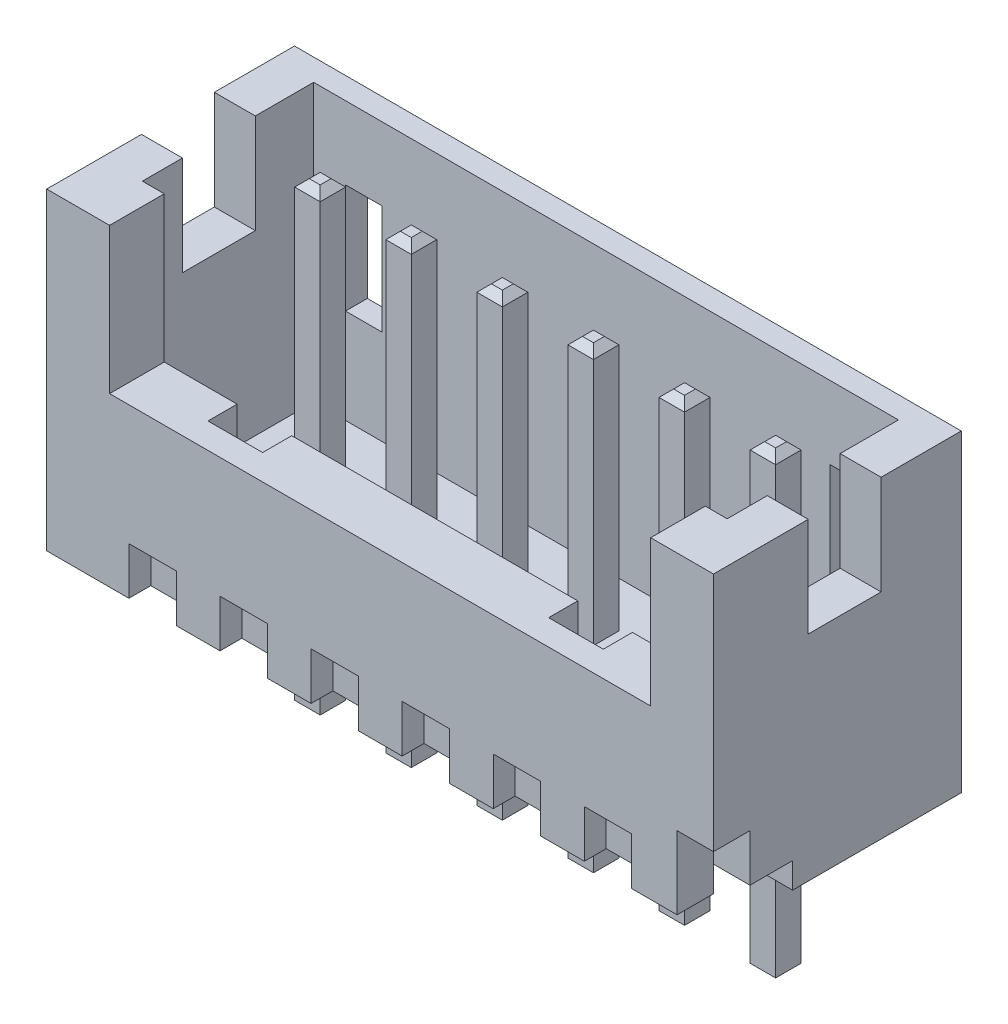
from build123d import *

# Parameters (mm, degrees)
SKETCH_1_W             = 9.15
SKETCH_1_H             = 3.4
EXTRUDE_1_DEPTH        = 4.3
SKETCH_2_W             = 8.025
SKETCH_2_H             = 2.35
CUT_EXTRUDE_1_DEPTH    = 3.8
CUT_EXTRUDE_2_REACH    = 9.14
SKETCH_3_W             = 7.425
SKETCH_3_H             = 2
CUT_EXTRUDE_3_REACH    = 9.14
SKETCH_4_W             = 0.5
SKETCH_4_H             = 1.5
PIN_DEPTH              = 3.5
PIN_DEPTH_BACK         = 2.8
SKETCH_5_W             = 0.35
SKETCH_5_H             = 0.35
CHAMFER_1_SIZE         = 0.1
PATTERN_LINEAR_3_COUNT = 6
PATTERN_LINEAR_3_PITCH = 1.25
SKETCH_6_W             = 1
SKETCH_6_H             = 1.363162743
CUT_EXTRUDE_5_DEPTH    = 0.5625
SKETCH_7_W             = 0.75
SKETCH_7_H             = 0.4
CUT_EXTRUDE_6_DEPTH    = 1.8
SKETCH_8_W             = 0.5
SKETCH_8_H             = 1
CUT_EXTRUDE_7_DEPTH    = 0.5
CUT_EXTRUDE_8_DEPTH    = 0.3
PATTERN_LINEAR_4_COUNT = 6
PATTERN_LINEAR_4_PITCH = 1.25
SKETCH_10_W            = 0.585441992
SKETCH_10_H            = 0.351135125
CUT_EXTRUDE_9_DEPTH    = 11.251951034


with BuildPart() as part:
    # Эскиз1 → Бобышка-Вытянуть1 (new body)
    with BuildSketch(Plane(origin=(0, 0, 0), x_dir=(1, 0, 0), z_dir=(0, 1, 0))):
        Rectangle(SKETCH_1_W, SKETCH_1_H)
    extrude(amount=EXTRUDE_1_DEPTH)

    # Эскиз2 → Вырез-Вытянуть1 (cut)
    with BuildSketch(Plane(origin=(0, 4.3, 0), x_dir=(1, 0, 0), z_dir=(0, 1, 0))):
        with Locations((0, 0.225)):
            Rectangle(SKETCH_2_W, SKETCH_2_H)
    extrude(amount=-CUT_EXTRUDE_1_DEPTH, mode=Mode.SUBTRACT)

    # Эскиз3 → Вырез-Вытянуть2 (cut, up to next)
    with BuildSketch(Plane.XY.offset(1.7), mode=Mode.PRIVATE) as cut_extrude_2_sk1:
        with Locations((0, 3.3)):
            Rectangle(SKETCH_3_W, SKETCH_3_H)
    cut_extrude_2_tool1 = extrude(cut_extrude_2_sk1.sketch, amount=-CUT_EXTRUDE_2_REACH, mode=Mode.PRIVATE) & part.part
    add(cut_extrude_2_tool1.solids().sort_by_distance((0, 3.3, 1.7))[0], mode=Mode.SUBTRACT)

    # Эскиз4 → Вырез-Вытянуть3 (cut, up to next)
    with BuildSketch(Plane(origin=(0, 0, -1.7), x_dir=(-1, 0, 0), z_dir=(0, 0, -1)), mode=Mode.PRIVATE) as cut_extrude_3_sk1:
        with Locations((-3.325, 2.55)):
            Rectangle(SKETCH_4_W, SKETCH_4_H)
    cut_extrude_3_tool1 = extrude(cut_extrude_3_sk1.sketch, amount=-CUT_EXTRUDE_3_REACH, mode=Mode.PRIVATE) & part.part
    # Эскиз4 → Вырез-Вытянуть3 (cut, up to next)
    with BuildSketch(Plane(origin=(0, 0, -1.7), x_dir=(-1, 0, 0), z_dir=(0, 0, -1)), mode=Mode.PRIVATE) as cut_extrude_3_sk2:
        with Locations((3.325, 2.55)):
            Rectangle(SKETCH_4_W, SKETCH_4_H)
    cut_extrude_3_tool2 = extrude(cut_extrude_3_sk2.sketch, amount=-CUT_EXTRUDE_3_REACH, mode=Mode.PRIVATE) & part.part
    add(cut_extrude_3_tool1.solids().sort_by_distance((3.325, 2.55, -1.7))[0], mode=Mode.SUBTRACT)
    add(cut_extrude_3_tool2.solids().sort_by_distance((-3.325, 2.55, -1.7))[0], mode=Mode.SUBTRACT)

    # Эскиз6 → Вырез-Вытянуть5 (cut)
    with BuildSketch(Plane.ZY.offset(4.575)):
        with Locations((-0.1, 3.618418629)):
            Rectangle(SKETCH_6_W, SKETCH_6_H)
    cut_extrude_5 = extrude(amount=-CUT_EXTRUDE_5_DEPTH, mode=Mode.SUBTRACT)

    # Эскиз7 → Вырез-Вытянуть6 (cut)
    with BuildSketch(Plane(origin=(0, 2.3, 0), x_dir=(1, 0, 0), z_dir=(0, 1, 0))):
        with Locations((-2.3375, -1.15)):
            Rectangle(SKETCH_7_W, SKETCH_7_H)
    cut_extrude_6 = extrude(amount=-CUT_EXTRUDE_6_DEPTH, mode=Mode.SUBTRACT)

    # Зеркальное отражение1: Вырез-Вытянуть5, Вырез-Вытянуть6 across plane
    add(cut_extrude_5.mirror(Plane(origin=(0, 0, 0), x_dir=(0, 0, 1), z_dir=(1, 0, 0))), mode=Mode.SUBTRACT)
    add(cut_extrude_6.mirror(Plane(origin=(0, 0, 0), x_dir=(0, 0, 1), z_dir=(1, 0, 0))), mode=Mode.SUBTRACT)

    # Эскиз8 → Вырез-Вытянуть7 (cut)
    with BuildSketch(Plane.XY.offset(1.7)):
        with Locations((4.325, 0.5)):
            Rectangle(SKETCH_8_W, SKETCH_8_H)
    extrude(amount=-CUT_EXTRUDE_7_DEPTH, mode=Mode.SUBTRACT)

    # Эскиз9 → Вырез-Вытянуть8 (cut)
    with BuildSketch(Plane.XY.offset(1.7)):
        Polygon((-3.4475, 0.65), (-3.4475, 0), (-2.7975, 0), (-2.7975, 0.65), (-3.1225, 0.65), align=None)
    cut_extrude_8 = extrude(amount=-CUT_EXTRUDE_8_DEPTH, mode=Mode.SUBTRACT)

    # Линейный массив4: Вырез-Вытянуть8 ×6
    with Locations(*[(i * PATTERN_LINEAR_4_PITCH, 0, 0) for i in range(1, PATTERN_LINEAR_4_COUNT)]):
        add(cut_extrude_8, mode=Mode.SUBTRACT)

    # Эскиз10 → Вырез-Вытянуть9 (cut, through all)
    with BuildSketch(Plane.ZY.offset(4.575)):
        with Locations((0.907435088, 0.175567563)):
            Rectangle(SKETCH_10_W, SKETCH_10_H)
    extrude(amount=-CUT_EXTRUDE_9_DEPTH, mode=Mode.SUBTRACT)


with BuildPart() as body_2:
    # Эскиз5 → Pin (new, two sides: drawn at the far end of the back side and taken through both)
    with BuildSketch(Plane(origin=(0, 0.5, 0), x_dir=(1, 0, 0), z_dir=(0, 1, 0)).offset(-PIN_DEPTH_BACK)):
        with Locations((-3.1225, 0.6)):
            Rectangle(SKETCH_5_W, SKETCH_5_H)
    extrude(amount=PIN_DEPTH + PIN_DEPTH_BACK)

    # Фаска1
    chamfer_1_edges = [body_2.edges().sort_by_distance(p)[0] for p in [
        (-2.9475, -2.3, -0.6),
        (-3.2975, 4, -0.6),
        (-3.1225, 4, -0.425),
        (-3.1225, -2.3, -0.775),
        (-2.9475, 4, -0.6),
        (-3.1225, 4, -0.775),
        (-3.2975, -2.3, -0.6),
        (-3.1225, -2.3, -0.425),
    ]]
    chamfer(chamfer_1_edges, length=CHAMFER_1_SIZE)


with BuildPart() as pattern_linear_3_1:
    # Линейный массив3: pattern copy
    add(body_2.part.moved(Location(Vector(1, 0, 0) * (1 * PATTERN_LINEAR_3_PITCH))))


with BuildPart() as pattern_linear_3_2:
    # Линейный массив3: pattern copy
    add(body_2.part.moved(Location(Vector(1, 0, 0) * (2 * PATTERN_LINEAR_3_PITCH))))


with BuildPart() as pattern_linear_3_3:
    # Линейный массив3: pattern copy
    add(body_2.part.moved(Location(Vector(1, 0, 0) * (3 * PATTERN_LINEAR_3_PITCH))))


with BuildPart() as pattern_linear_3_4:
    # Линейный массив3: pattern copy
    add(body_2.part.moved(Location(Vector(1, 0, 0) * (4 * PATTERN_LINEAR_3_PITCH))))


with BuildPart() as pattern_linear_3_5:
    # Линейный массив3: pattern copy
    add(body_2.part.moved(Location(Vector(1, 0, 0) * (5 * PATTERN_LINEAR_3_PITCH))))


solid = Compound([part.part, body_2.part, pattern_linear_3_1.part, pattern_linear_3_2.part, pattern_linear_3_3.part, pattern_linear_3_4.part, pattern_linear_3_5.part])
